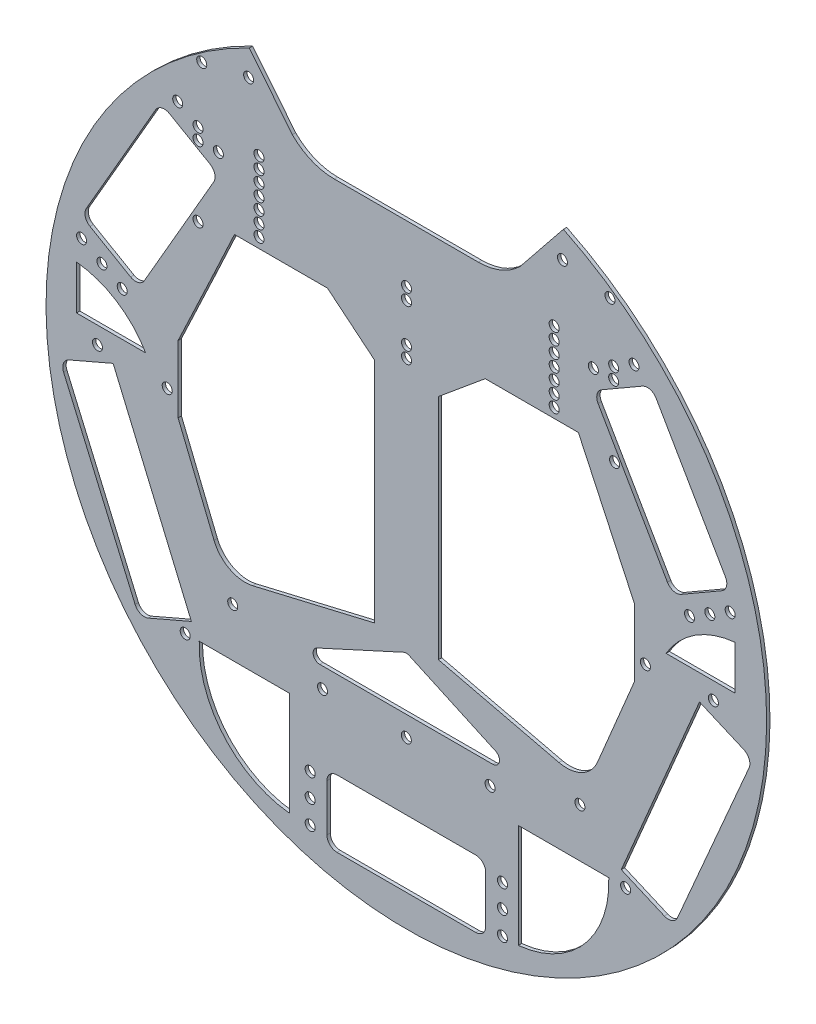
from build123d import *

# Parameters (mm, degrees)
MODEL_R                 = 1.5
SALIENTE_EXTRUIR1_DEPTH = 1


with BuildPart() as part:
    # Model → Saliente-Extruir1 (new body)
    with BuildSketch(Plane.XY):
        with BuildLine():
            Line((-132.124073019, 96.171647673), (-144.982236662, 112.171647673))
            ThreePointArc((-144.982236662, 112.171647673), (-98.124073019, -92.078352327), (-51.265909376, 112.171647673))
            Line((-51.265909376, 112.171647673), (-64.124073019, 96.171647673))
            ThreePointArc((-64.124073019, 96.171647673), (-69.859121767, 92.339610612), (-76.624073019, 90.993978143))
            Line((-76.624073019, 90.993978143), (-119.624073019, 90.993978143))
            ThreePointArc((-119.624073019, 90.993978143), (-126.389024271, 92.339610612), (-132.124073019, 96.171647673))
        make_face()
        with Locations((-164.091477503, -48.692752703)):
            Circle(MODEL_R, mode=Mode.SUBTRACT)
        with Locations((-126.80799372, -79.578352328)):
            Circle(MODEL_R, mode=Mode.SUBTRACT)
        with Locations((-126.80799372, -72.578352328)):
            Circle(MODEL_R, mode=Mode.SUBTRACT)
        with BuildLine():
            Line((-121.80799372, -79.578352328), (-121.80799372, -65.578352328))
            ThreePointArc((-121.80799372, -65.578352328), (-120.929314064, -63.457031984), (-118.80799372, -62.578352328))
            Line((-118.80799372, -62.578352328), (-77.44039372, -62.578352328))
            ThreePointArc((-77.44039372, -62.578352328), (-75.319073377, -63.457031984), (-74.44039372, -65.578352328))
            Line((-74.44039372, -65.578352328), (-74.44039372, -79.578352328))
            ThreePointArc((-74.44039372, -79.578352328), (-75.319073377, -81.699672671), (-77.44039372, -82.578352328))
            Line((-77.44039372, -82.578352328), (-118.80799372, -82.578352328))
            ThreePointArc((-118.80799372, -82.578352328), (-120.929314064, -81.699672671), (-121.80799372, -79.578352328))
        make_face(mode=Mode.SUBTRACT)
        with BuildLine():
            ThreePointArc((-132.908728971, -79.578352328), (-152.55673917, -69.433070888), (-159.908728971, -48.578352328))
            Line((-159.908728971, -48.578352328), (-132.908728971, -48.578352328))
            Line((-132.908728971, -48.578352328), (-132.908728971, -79.578352328))
        make_face(mode=Mode.SUBTRACT)
        with Locations((-126.80799372, -65.692752703)):
            Circle(MODEL_R, mode=Mode.SUBTRACT)
        with Locations((-123.12419372, -42.578352328)):
            Circle(MODEL_R, mode=Mode.SUBTRACT)
        with Locations((-98.12419372, -42.578352328)):
            Circle(MODEL_R, mode=Mode.SUBTRACT)
        with BuildLine():
            ThreePointArc((-175.108108054, -50.198112818), (-177.403942548, -50.2330687), (-179.052060228, -48.634386101))
            Line((-179.052060228, -48.634386101), (-200.374412871, 0.704079384))
            ThreePointArc((-200.374412871, 0.704079384), (-200.409368752, 2.999913878), (-198.810686153, 4.648031558))
            Line((-198.810686153, 4.648031558), (-185.598485753, 10.357880727))
            Line((-185.598485753, 10.357880727), (-162.252300826, -44.642284267))
            Line((-162.252300826, -44.642284267), (-175.108108054, -50.198112818))
        make_face(mode=Mode.SUBTRACT)
        with Locations((-149.919608588, -34.027630651)):
            Circle(MODEL_R, mode=Mode.SUBTRACT)
        with BuildLine():
            Line((-72.309664072, -36.578352328), (-123.938723369, -36.578352328))
            ThreePointArc((-123.938723369, -36.578352328), (-125.892936498, -35.003853266), (-124.77024289, -32.759403376))
            Line((-124.77024289, -32.759403376), (-98.955713241, -20.958475537))
            ThreePointArc((-98.955713241, -20.958475537), (-98.12419372, -20.777424488), (-97.2926742, -20.958475537))
            Line((-97.2926742, -20.958475537), (-71.478144551, -32.759403376))
            ThreePointArc((-71.478144551, -32.759403376), (-70.355450943, -35.003853266), (-72.309664072, -36.578352328))
        make_face(mode=Mode.SUBTRACT)
        with Locations((-69.44039372, -79.578352328)):
            Circle(MODEL_R, mode=Mode.SUBTRACT)
        with Locations((-69.44039372, -72.578352328)):
            Circle(MODEL_R, mode=Mode.SUBTRACT)
        with Locations((-73.12419372, -42.578352328)):
            Circle(MODEL_R, mode=Mode.SUBTRACT)
        with Locations((-69.44039372, -65.692752703)):
            Circle(MODEL_R, mode=Mode.SUBTRACT)
        with BuildLine():
            Line((-64.720174348, -79.578352328), (-64.720174348, -48.578352328))
            Line((-64.720174348, -48.578352328), (-37.720174348, -48.578352328))
            ThreePointArc((-37.720174348, -48.578352328), (-45.072164149, -69.433070888), (-64.720174348, -79.578352328))
        make_face(mode=Mode.SUBTRACT)
        with Locations((-32.695346502, -48.692752703)):
            Circle(MODEL_R, mode=Mode.SUBTRACT)
        with Locations((-46.32853745, -34.027630651)):
            Circle(MODEL_R, mode=Mode.SUBTRACT)
        with BuildLine():
            ThreePointArc((2.562540115, 4.648031558), (4.161222714, 2.999913878), (4.126266833, 0.704079384))
            Line((4.126266833, 0.704079384), (-17.19608581, -48.634386101))
            ThreePointArc((-17.19608581, -48.634386101), (-18.84420349, -50.2330687), (-21.140037984, -50.198112818))
            Line((-21.140037984, -50.198112818), (-33.995845212, -44.642284267))
            Line((-33.995845212, -44.642284267), (-10.649660285, 10.357880727))
            Line((-10.649660285, 10.357880727), (2.562540115, 4.648031558))
        make_face(mode=Mode.SUBTRACT)
        with Locations((-190.276022735, 12.807247298)):
            Circle(MODEL_R, mode=Mode.SUBTRACT)
        with BuildLine():
            Line((-175.885844752, 17.921647673), (-196.50666337, 17.921647673))
            Line((-196.50666337, 17.921647673), (-196.50666337, 31.0807483))
            ThreePointArc((-196.50666337, 31.0807483), (-184.615099343, 26.978928462), (-175.885844752, 17.921647673))
        make_face(mode=Mode.SUBTRACT)
        with Locations((-188.944485544, 34.468187661)):
            Circle(MODEL_R, mode=Mode.SUBTRACT)
        with Locations((-182.882307717, 30.968187661)):
            Circle(MODEL_R, mode=Mode.SUBTRACT)
        with Locations((-169.456165013, 11.997612022)):
            Circle(MODEL_R, mode=Mode.SUBTRACT)
        with Locations((-195.00666337, 37.968187661)):
            Circle(MODEL_R, mode=Mode.SUBTRACT)
        with BuildLine():
            Line((-168.823925542, 83.31801986), (-156.699569889, 76.31801986))
            ThreePointArc((-156.699569889, 76.31801986), (-155.301792411, 74.496400784), (-155.601493678, 72.219943649))
            Line((-155.601493678, 72.219943649), (-176.284231506, 36.396390892))
            ThreePointArc((-176.284231506, 36.396390892), (-178.105850582, 34.998613413), (-180.382307717, 35.29831468))
            Line((-180.382307717, 35.29831468), (-192.50666337, 42.29831468))
            ThreePointArc((-192.50666337, 42.29831468), (-193.904440849, 44.119933756), (-193.604739582, 46.396390892))
            Line((-193.604739582, 46.396390892), (-172.922001754, 82.219943649))
            ThreePointArc((-172.922001754, 82.219943649), (-171.100382678, 83.617721128), (-168.823925542, 83.31801986))
        make_face(mode=Mode.SUBTRACT)
        with Locations((-160.261747716, 59.648146879)):
            Circle(MODEL_R, mode=Mode.SUBTRACT)
        with BuildLine():
            ThreePointArc((-143.946358453, -26.262048827), (-150.820635127, -25.414893373), (-155.495547467, -20.304262613))
            Line((-155.495547467, -20.304262613), (-166.214048754, 5.975749638))
            Line((-166.214048754, 5.975749638), (-166.214048754, 25.975749638))
            Line((-166.214048754, 25.975749638), (-155.648592211, 48.364767495))
            Line((-155.648592211, 48.364767495), (-149.396648307, 61.772104462))
            Line((-149.396648307, 61.772104462), (-121.645358041, 61.772104462))
            Line((-121.645358041, 61.772104462), (-107.666591556, 50.27172818))
            Line((-107.666591556, 50.27172818), (-107.666591556, -17.72827182))
            Line((-107.666591556, -17.72827182), (-143.946358453, -26.262048827))
        make_face(mode=Mode.SUBTRACT)
        with Locations((-160.261747716, 80.648146879)):
            Circle(MODEL_R, mode=Mode.SUBTRACT)
        with Locations((-160.261747716, 84.148146879)):
            Circle(MODEL_R, mode=Mode.SUBTRACT)
        with Locations((-154.199569889, 80.648146879)):
            Circle(MODEL_R, mode=Mode.SUBTRACT)
        with Locations((-166.323925542, 87.648146879)):
            Circle(MODEL_R, mode=Mode.SUBTRACT)
        with Locations((-159.164734036, 101.381623803)):
            Circle(MODEL_R, mode=Mode.SUBTRACT)
        with Locations((-142.07416748, 64.771274036)):
            Circle(MODEL_R, mode=Mode.SUBTRACT)
        with Locations((-142.07416748, 68.271274036)):
            Circle(MODEL_R, mode=Mode.SUBTRACT)
        with Locations((-142.07416748, 71.771274036)):
            Circle(MODEL_R, mode=Mode.SUBTRACT)
        with Locations((-142.07416748, 75.271274036)):
            Circle(MODEL_R, mode=Mode.SUBTRACT)
        with Locations((-142.07416748, 78.771274036)):
            Circle(MODEL_R, mode=Mode.SUBTRACT)
        with Locations((-142.07416748, 82.271274036)):
            Circle(MODEL_R, mode=Mode.SUBTRACT)
        with Locations((-142.07416748, 85.771274036)):
            Circle(MODEL_R, mode=Mode.SUBTRACT)
        with Locations((-145.161542692, 104.447130968)):
            Circle(MODEL_R, mode=Mode.SUBTRACT)
        with BuildLine():
            ThreePointArc((-41.067560649, -20.384225601), (-45.76096324, -25.437659469), (-52.609605514, -26.25087576))
            Line((-52.609605514, -26.25087576), (-88.556731367, -17.686913331))
            Line((-88.556731367, -17.686913331), (-88.556731367, 50.313086669))
            Line((-88.556731367, 50.313086669), (-74.586200902, 61.908450919))
            Line((-74.586200902, 61.908450919), (-46.789791069, 61.908450919))
            Line((-46.789791069, 61.908450919), (-30.034097284, 25.975749638))
            Line((-30.034097284, 25.975749638), (-30.034097284, 5.975749638))
            Line((-30.034097284, 5.975749638), (-41.067560649, -20.384225601))
        make_face(mode=Mode.SUBTRACT)
        with Locations((-98.067178856, 55.42750716)):
            Circle(MODEL_R, mode=Mode.SUBTRACT)
        with Locations((-98.067178856, 58.893210919)):
            Circle(MODEL_R, mode=Mode.SUBTRACT)
        with Locations((-26.791981025, 11.997612022)):
            Circle(MODEL_R, mode=Mode.SUBTRACT)
        with Locations((-6.510821651, 12.807247298)):
            Circle(MODEL_R, mode=Mode.SUBTRACT)
        with BuildLine():
            ThreePointArc((-20.630578097, 17.921647673), (-11.901323506, 26.978928462), (-0.009759479, 31.0807483))
            Line((-0.009759479, 31.0807483), (-0.009759479, 17.921647673))
            Line((-0.009759479, 17.921647673), (-20.630578097, 17.921647673))
        make_face(mode=Mode.SUBTRACT)
        with Locations((-13.634115132, 31.0807483)):
            Circle(MODEL_R, mode=Mode.SUBTRACT)
        with Locations((-7.571937305, 34.5807483)):
            Circle(MODEL_R, mode=Mode.SUBTRACT)
        with Locations((-35.986398322, 59.648146879)):
            Circle(MODEL_R, mode=Mode.SUBTRACT)
        with BuildLine():
            Line((-4.009759479, 42.410875319), (-16.134115132, 35.410875319))
            ThreePointArc((-16.134115132, 35.410875319), (-18.410572267, 35.111174052), (-20.232191343, 36.508951531))
            Line((-20.232191343, 36.508951531), (-40.915991343, 72.334344024))
            ThreePointArc((-40.915991343, 72.334344024), (-41.215692611, 74.610801159), (-39.817915132, 76.432420236))
            Line((-39.817915132, 76.432420236), (-27.693559479, 83.432420236))
            ThreePointArc((-27.693559479, 83.432420236), (-25.417102344, 83.732121503), (-23.595483268, 82.334344024))
            Line((-23.595483268, 82.334344024), (-2.911683268, 46.508951531))
            ThreePointArc((-2.911683268, 46.508951531), (-2.611982, 44.232494395), (-4.009759479, 42.410875319))
        make_face(mode=Mode.SUBTRACT)
        with Locations((-1.509759479, 38.0807483)):
            Circle(MODEL_R, mode=Mode.SUBTRACT)
        with Locations((-98.067178856, 70.42750716)):
            Circle(MODEL_R, mode=Mode.SUBTRACT)
        with Locations((-98.067178856, 73.893210919)):
            Circle(MODEL_R, mode=Mode.SUBTRACT)
        with Locations((-54.011973019, 64.771023428)):
            Circle(MODEL_R, mode=Mode.SUBTRACT)
        with Locations((-54.011973019, 68.271023428)):
            Circle(MODEL_R, mode=Mode.SUBTRACT)
        with Locations((-54.011973019, 71.771023428)):
            Circle(MODEL_R, mode=Mode.SUBTRACT)
        with Locations((-54.011973019, 75.271023428)):
            Circle(MODEL_R, mode=Mode.SUBTRACT)
        with Locations((-54.011973019, 78.771023428)):
            Circle(MODEL_R, mode=Mode.SUBTRACT)
        with Locations((-54.011973019, 82.271023428)):
            Circle(MODEL_R, mode=Mode.SUBTRACT)
        with Locations((-54.011973019, 85.771023428)):
            Circle(MODEL_R, mode=Mode.SUBTRACT)
        with Locations((-51.541788901, 104.13375006)):
            Circle(MODEL_R, mode=Mode.SUBTRACT)
        with Locations((-42.317915132, 80.762547254)):
            Circle(MODEL_R, mode=Mode.SUBTRACT)
        with Locations((-36.255737305, 80.762547254)):
            Circle(MODEL_R, mode=Mode.SUBTRACT)
        with Locations((-36.255737305, 84.262547254)):
            Circle(MODEL_R, mode=Mode.SUBTRACT)
        with Locations((-30.193559479, 87.762547254)):
            Circle(MODEL_R, mode=Mode.SUBTRACT)
        with Locations((-37.374734036, 101.390823803)):
            Circle(MODEL_R, mode=Mode.SUBTRACT)
    extrude(amount=SALIENTE_EXTRUIR1_DEPTH)


solid = part.part
